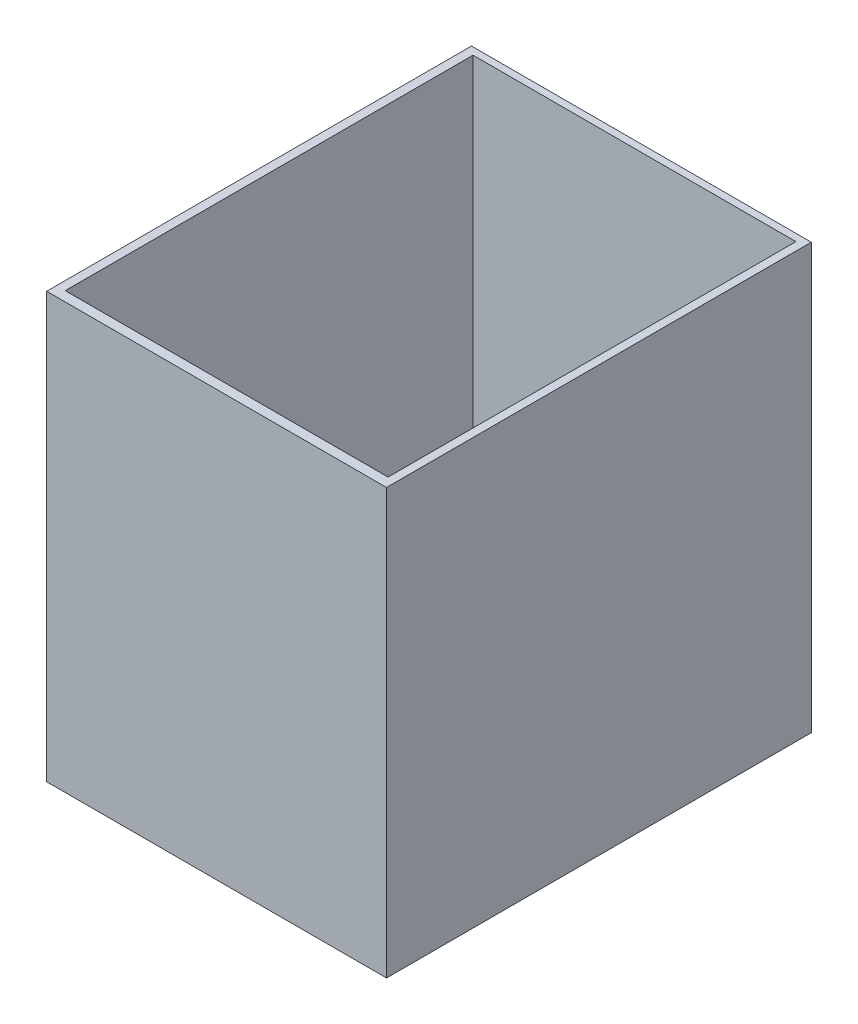
from build123d import *

# Parameters (mm, degrees)
SKETCH1_W           = 800
SKETCH1_H           = 1000
BOSS_EXTRUDE1_DEPTH = 1000
SKETCH5_W           = 760
SKETCH5_H           = 960
CUT_EXTRUDE1_DEPTH  = 960


with BuildPart() as part:
    # Sketch1 → Boss-Extrude1 (new body)
    with BuildSketch(Plane.XY):
        Rectangle(SKETCH1_W, SKETCH1_H)
    extrude(amount=BOSS_EXTRUDE1_DEPTH)

    # Sketch5 → Cut-Extrude1 (cut)
    with BuildSketch(Plane(origin=(0, 500, 0), x_dir=(1, 0, 0), z_dir=(0, 1, 0))):
        with Locations((0.588350419, -496.906811406)):
            Rectangle(SKETCH5_W, SKETCH5_H)
    extrude(amount=-CUT_EXTRUDE1_DEPTH, mode=Mode.SUBTRACT)


solid = part.part
